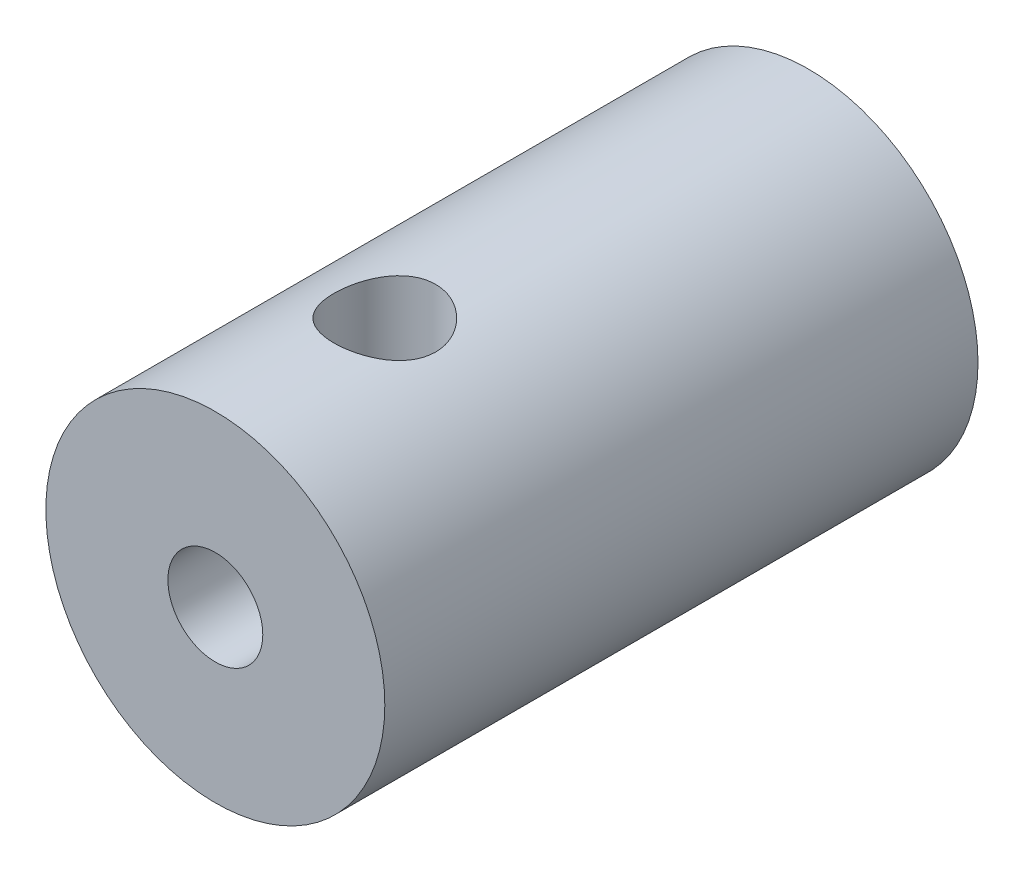
from build123d import *

# Parameters (mm, degrees)
SKETCH1_R               = 10
BOSS_EXTRUDE1_DEPTH     = 35
SKETCH2_R               = 2.9
CUT_EXTRUDE1_DEPTH      = 12
CUT_EXTRUDE1_DRAFT      = -1
CUT_EXTRUDE2_DEPTH      = 38.749172176
CUT_EXTRUDE2_DEPTH_BACK = 38.749172176
SKETCH3_R               = 3
CUT_EXTRUDE3_REACH      = 39.749
CUT_EXTRUDE3_END_RADIUS = 3
SKETCH4_R               = 2.8


with BuildPart() as part:
    # Sketch1 → Boss-Extrude1 (new body)
    with BuildSketch(Plane.XY):
        Circle(SKETCH1_R)
    extrude(amount=BOSS_EXTRUDE1_DEPTH)


with BuildPart() as cut_extrude1_tool:
    # Sketch2 → Cut-Extrude1 (with draft: the straight prism first)
    with BuildSketch(Plane(origin=(0, 0, 12), x_dir=(-1, 0, 0), z_dir=(0, 0, -1))):
        Circle(SKETCH2_R)
    extrude(amount=CUT_EXTRUDE1_DEPTH)
    # Cut-Extrude1: the draft: its side faces are tilted about the plane it starts from
    cut_extrude1_sides = [cut_extrude1_tool.faces().sort_by_distance(p)[0] for p in [
        (2.9, 0, 6),
    ]]
    draft(cut_extrude1_sides, Plane(origin=(0, 0, 12), x_dir=(-1, 0, 0), z_dir=(0, 0, -1)), CUT_EXTRUDE1_DRAFT)


with BuildPart() as part_1:
    add(part.part)

    # Cut-Extrude1: cut by cut_extrude1_tool
    add(cut_extrude1_tool.part, mode=Mode.SUBTRACT)

    # Sketch3 → Cut-Extrude2 (cut, two sides: drawn at the far end of the back side and taken through both)
    with BuildSketch(Plane(origin=(0, 0, 0), x_dir=(1, 0, 0), z_dir=(0, 1, 0)).offset(-CUT_EXTRUDE2_DEPTH_BACK)):
        with Locations(Location((0, -25, 0), (0, 0, 270))):
            Circle(SKETCH3_R)
    extrude(amount=CUT_EXTRUDE2_DEPTH + CUT_EXTRUDE2_DEPTH_BACK, mode=Mode.SUBTRACT)

    # Cut-Extrude3: up to this cylinder (the profile starts outside it)
    cut_extrude3_end = Plane(origin=(0, 0, 25), z_dir=(0, 1, 0)) * Cylinder(CUT_EXTRUDE3_END_RADIUS, 86.498, mode=Mode.PRIVATE)
    # Sketch4 → Cut-Extrude3 (cut, up to the surface)
    with BuildSketch(Plane.XY.offset(35), mode=Mode.PRIVATE) as cut_extrude3_sk1:
        Circle(SKETCH4_R)
    cut_extrude3_tool1 = extrude(cut_extrude3_sk1.sketch, amount=-CUT_EXTRUDE3_REACH, mode=Mode.PRIVATE) - cut_extrude3_end
    add(cut_extrude3_tool1.solids().sort_by_distance((0, 0, 35))[0], mode=Mode.SUBTRACT)


solid = part_1.part
